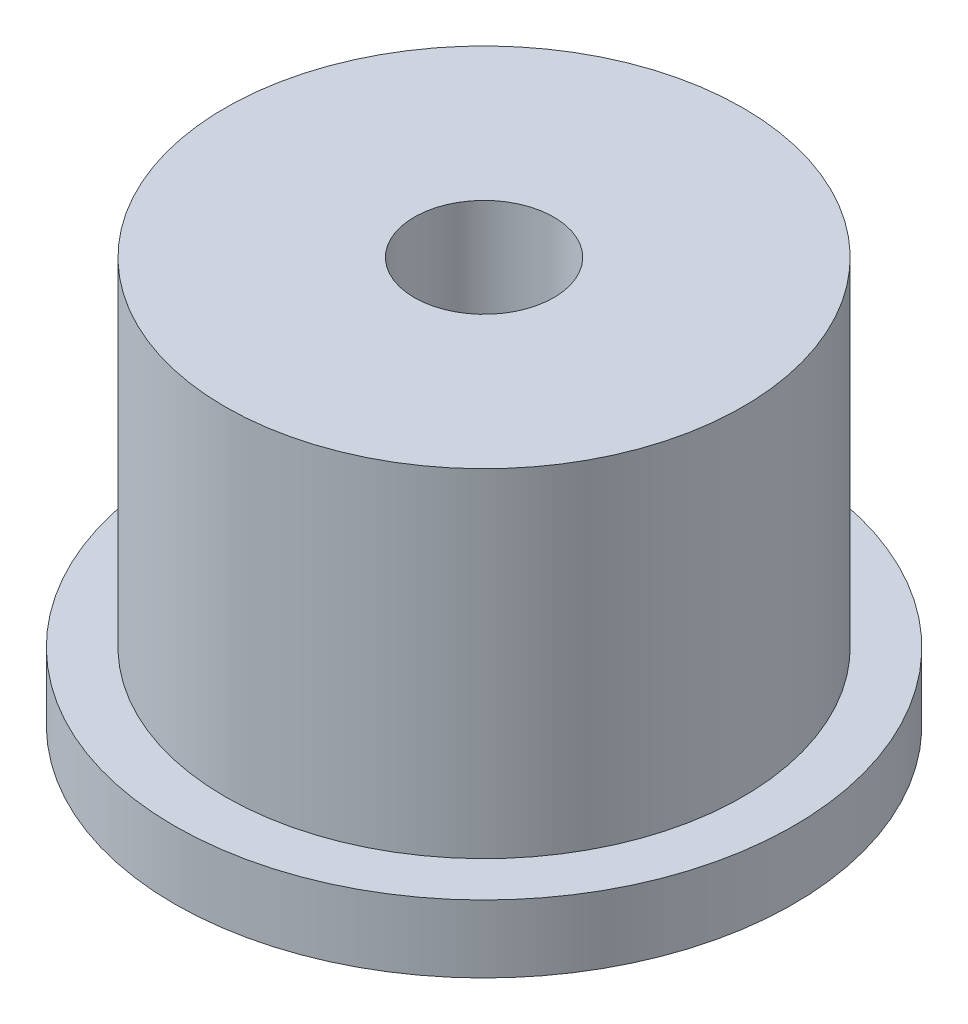
from build123d import *

# Parameters (mm, degrees)
SKETCH1_R           = 13.75
BOSS_EXTRUDE1_DEPTH = 3
SKETCH2_R           = 11.5
BOSS_EXTRUDE2_DEPTH = 15
SKETCH3_R           = 3.1
CUT_EXTRUDE1_DEPTH  = 27.497641404


with BuildPart() as part:
    # Sketch1 → Boss-Extrude1 (new body)
    with BuildSketch(Plane(origin=(0, 0, 0), x_dir=(1, 0, 0), z_dir=(0, 1, 0))):
        with Locations(Location((0, 0, 0), (0, 0, 270))):
            Circle(SKETCH1_R)
    extrude(amount=BOSS_EXTRUDE1_DEPTH)

    # Sketch2 → Boss-Extrude2 (add)
    with BuildSketch(Plane(origin=(0, 3, 0), x_dir=(1, 0, 0), z_dir=(0, 1, 0))):
        with Locations(Location((0, 0, 0), (0, 0, 270))):
            Circle(SKETCH2_R)
    extrude(amount=BOSS_EXTRUDE2_DEPTH)

    # Sketch3 → Cut-Extrude1 (cut, through all)
    with BuildSketch(Plane(origin=(0, 18, 0), x_dir=(1, 0, 0), z_dir=(0, 1, 0))):
        with Locations(Location((0, 0, 0), (0, 0, 270))):
            Circle(SKETCH3_R)
    extrude(amount=-CUT_EXTRUDE1_DEPTH, mode=Mode.SUBTRACT)


solid = part.part
